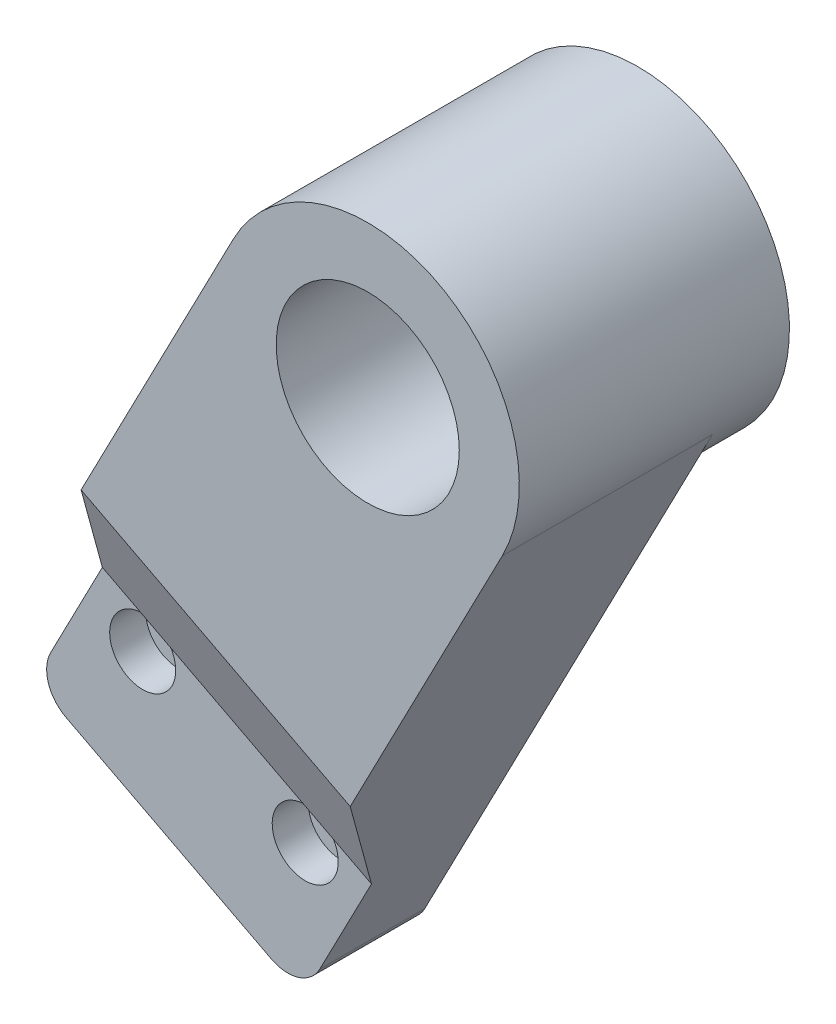
from build123d import *

# Parameters (mm, degrees)
SKETCH_1_R          = 12.625
SKETCH_1_R_2        = 7.625
EXTRUDE_1_DEPTH     = 22.5
EXTRUDE_2_DEPTH     = 17.499994584
CUT_EXTRUDE_1_DEPTH = 70.296381035
FILLET_1_R          = 3
SKETCH_4_R          = 1.6
CUT_EXTRUDE_5_DEPTH = 66.731667206
SKETCH_5_R          = 2.75
CUT_EXTRUDE_6_DEPTH = 3


with BuildPart() as part:
    # 草图1 → 凸台-拉伸1 (new body)
    with BuildSketch(Plane.XY):
        Circle(SKETCH_1_R)
        Circle(SKETCH_1_R_2, mode=Mode.SUBTRACT)
    extrude(amount=-EXTRUDE_1_DEPTH)

    # 草图2 → 凸台-拉伸2 (add)
    with BuildSketch(Plane.XY):
        with BuildLine():
            Line((11.206194864, -5.814793347), (-14.125578135, -54.633860081))
            Line((-14.125578135, -54.633860081), (-36.537967862, -43.004273386))
            Line((-36.537967862, -43.004273386), (-11.206194864, 5.814793347))
            ThreePointArc((-11.206194864, 5.814793347), (-5.814793347, -11.206194864), (11.206194864, -5.814793347))
        make_face()
    extrude(amount=-EXTRUDE_2_DEPTH)

    # 草图3 → 切除-拉伸1 (cut, through all)
    with BuildSketch(Plane(origin=(-11.206194864, 5.814793347, 0), x_dir=(0, 0, 1), z_dir=(-0.8876193951581107, 0.46057769088303635, 0))):
        Polygon((-8.749997893, -55), (-8.749997893, -42.655440917), (0, -27.5), (0, -55), align=None)
    extrude(amount=-CUT_EXTRUDE_1_DEPTH, mode=Mode.SUBTRACT)

    # 圆角1
    fillet_1_edges = [part.edges().sort_by_distance(p)[0] for p in [
        (-14.125578135, -54.633860081, -13.124996239),
        (-36.537967862, -43.004273386, -13.124996239),
    ]]
    fillet(fillet_1_edges, radius=FILLET_1_R)

    # 草图4 → 切除-拉伸5 (cut, through all)
    with BuildSketch(Plane.XY.offset(-8.749997893)):
        with Locations((-13.957898202, -43.454777675)):
            Circle(SKETCH_4_R)
        with Locations((-27.494093978, -36.430967889)):
            Circle(SKETCH_4_R)
    extrude(amount=-CUT_EXTRUDE_5_DEPTH, mode=Mode.SUBTRACT)

    # 草图5 → 切除-拉伸6 (cut)
    with BuildSketch(Plane.XY.offset(-8.749997893)):
        with Locations((-13.957898202, -43.454777675)):
            Circle(SKETCH_5_R)
        with Locations((-27.494093978, -36.430967889)):
            Circle(SKETCH_5_R)
    extrude(amount=-CUT_EXTRUDE_6_DEPTH, mode=Mode.SUBTRACT)


solid = part.part
